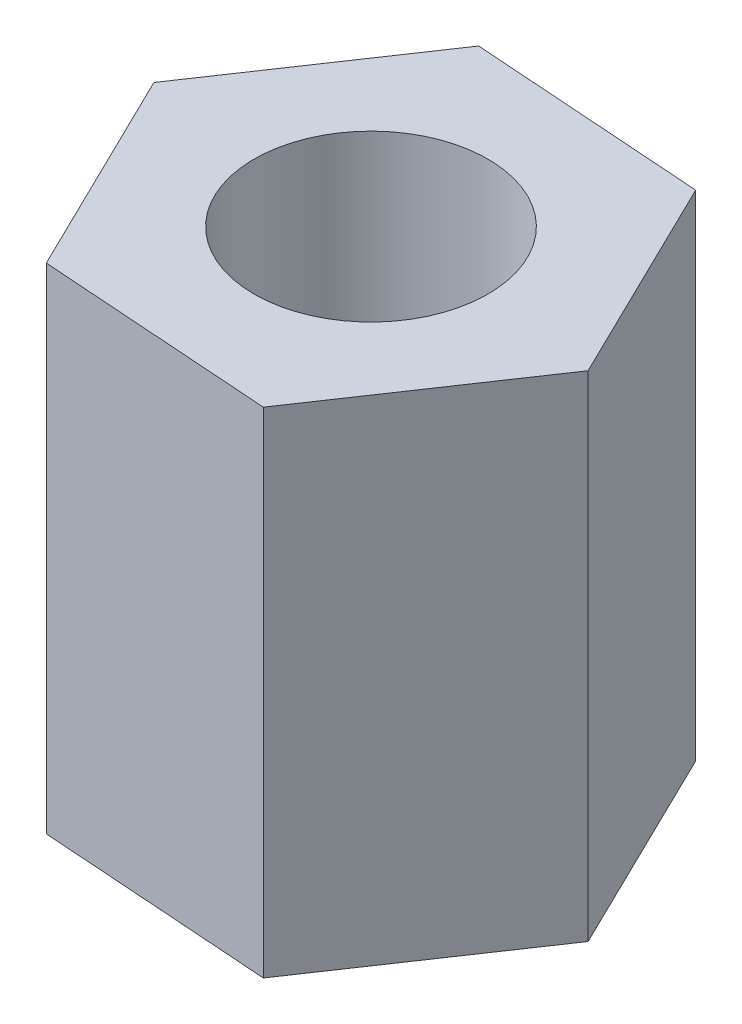
from build123d import *

# Parameters (mm, degrees)
SKETCH_1_R      = 1.5
EXTRUDE_1_DEPTH = 6.34


with BuildPart() as part:
    # 草图1 → 凸台-拉伸1 (new body)
    with BuildSketch(Plane(origin=(0, 0, 0), x_dir=(1, 0, 0), z_dir=(0, 1, 0))):
        Polygon((-2.992723219, 0.208824653), (-1.677209063, -2.487362008), (1.315514155, -2.69618666), (2.992723219, -0.208824653), (1.677209063, 2.487362008), (-1.315514155, 2.69618666), align=None)
        with Locations(Location((0, 0, 0), (0, 0, 270))):
            Circle(SKETCH_1_R, mode=Mode.SUBTRACT)
    extrude(amount=EXTRUDE_1_DEPTH)


solid = part.part
